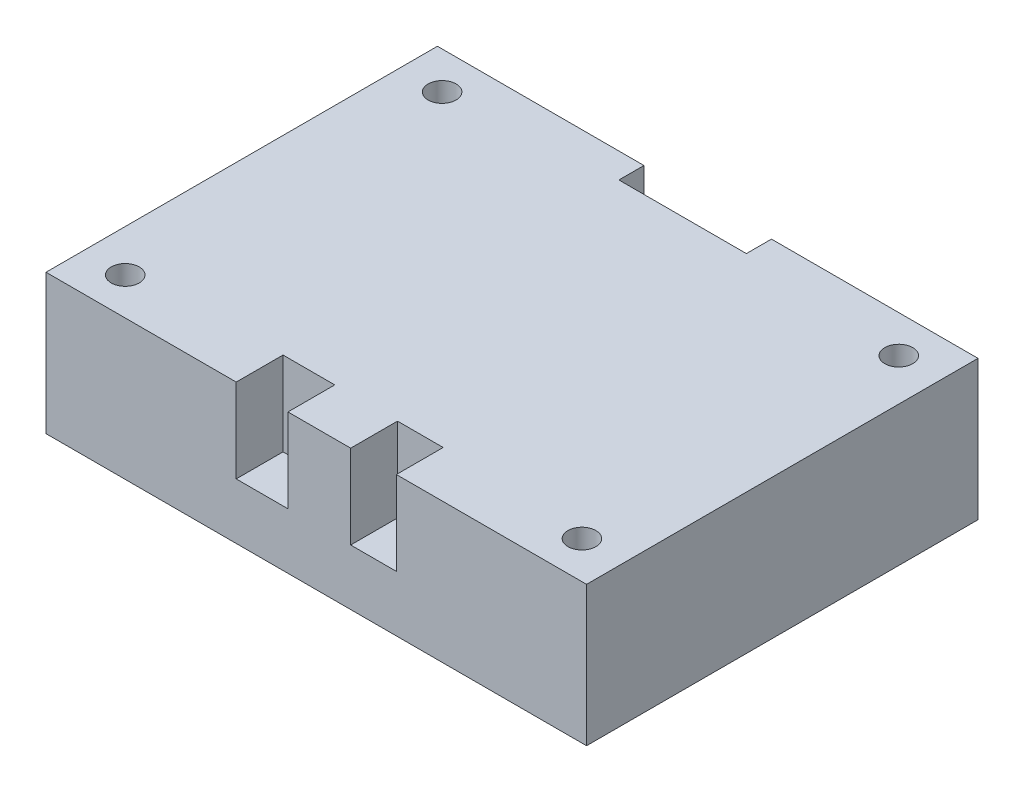
from build123d import *

# Parameters (mm, degrees)
SKETCH_1_W          = 58
SKETCH_1_H          = 42
SKETCH_1_R          = 1.5
EXTRUDE_1_DEPTH     = 15
SKETCH_2_W          = 13.679310014
SKETCH_2_H          = 5.381736476
CUT_EXTRUDE_1_DEPTH = 12
SKETCH_3_W          = 17.182547944
SKETCH_3_H          = 10.048106392
CUT_EXTRUDE_2_DEPTH = 9
SKETCH_4_W          = 6.72992405
SKETCH_4_H          = 5.024053196
EXTRUDE_2_DEPTH     = 9


with BuildPart() as part:
    # 草图1 → 凸台-拉伸1 (new body)
    with BuildSketch(Plane(origin=(0, 0, 0), x_dir=(1, 0, 0), z_dir=(0, 1, 0))):
        Rectangle(SKETCH_1_W, SKETCH_1_H)
        with Locations(Location((-24.5, 17, 0), (0, 0, 270))):
            Circle(SKETCH_1_R, mode=Mode.SUBTRACT)
        with Locations(Location((-24.5, -17, 0), (0, 0, 90))):
            Circle(SKETCH_1_R, mode=Mode.SUBTRACT)
        with Locations(Location((24.5, -17, 0), (0, 0, 270))):
            Circle(SKETCH_1_R, mode=Mode.SUBTRACT)
        with Locations(Location((24.5, 17, 0), (0, 0, 90))):
            Circle(SKETCH_1_R, mode=Mode.SUBTRACT)
    extrude(amount=EXTRUDE_1_DEPTH)

    # 草图2 → 切除-拉伸1 (cut)
    with BuildSketch(Plane(origin=(0, 15, 0), x_dir=(1, 0, 0), z_dir=(0, 1, 0))):
        with Locations((0, 21)):
            Rectangle(SKETCH_2_W, SKETCH_2_H)
    extrude(amount=-CUT_EXTRUDE_1_DEPTH, mode=Mode.SUBTRACT)

    # 草图3 → 切除-拉伸2 (cut)
    with BuildSketch(Plane(origin=(0, 15, 0), x_dir=(1, 0, 0), z_dir=(0, 1, 0))):
        with Locations((0, -21)):
            Rectangle(SKETCH_3_W, SKETCH_3_H)
    extrude(amount=-CUT_EXTRUDE_2_DEPTH, mode=Mode.SUBTRACT)

    # 草图4 → 凸台-拉伸2 (add)
    with BuildSketch(Plane(origin=(0, 6, 0), x_dir=(1, 0, 0), z_dir=(0, 1, 0))):
        with Locations((0.325641486, -18.487973402)):
            Rectangle(SKETCH_4_W, SKETCH_4_H)
    extrude(amount=EXTRUDE_2_DEPTH)


solid = part.part
